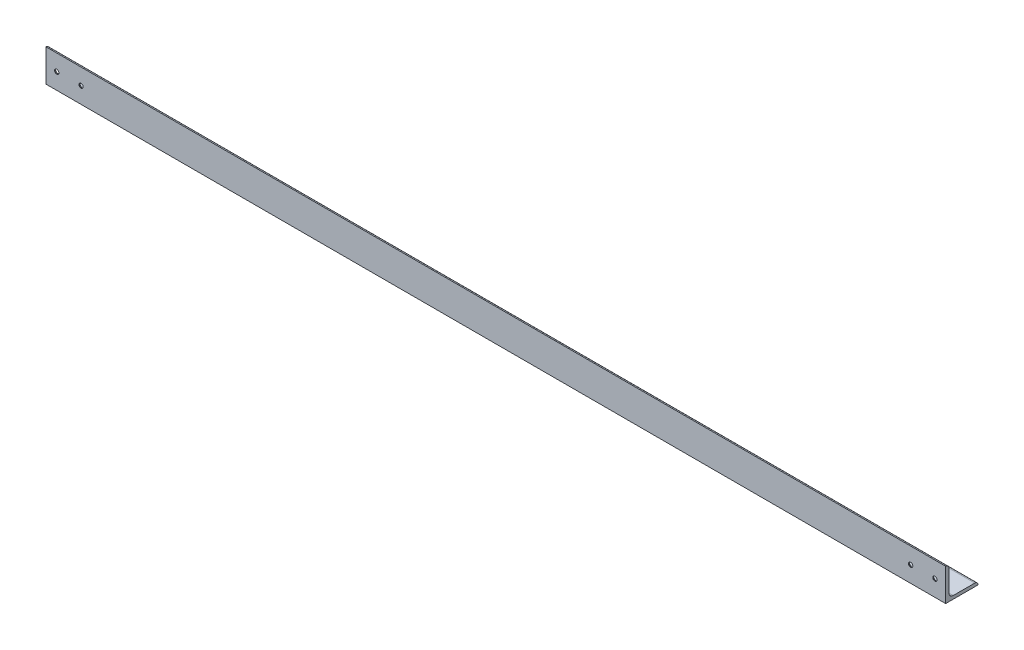
from build123d import *

# Parameters (mm, degrees)
L_ANGLE_EQUAL_60X60X6_6_DEPTH = 1670
SKETCH14_R                    = 4
CUT_EXTRUDE1_DEPTH            = 1673.1542991
CHAMFER1_SIZE                 = 5.5
SKETCH18_R                    = 4
CUT_EXTRUDE2_DEPTH            = 1673.1542991
LPATTERN1_COUNT               = 5
LPATTERN1_PITCH               = 400
LPATTERN1_COUNT_DIR2          = 5
LPATTERN1_PITCH_DIR2          = 400


with BuildPart() as part:
    # Sketch17 → L angle (equal) 60X60X6(6) (new body)
    with BuildSketch(Plane(origin=(0, 0, 0), x_dir=(0, 0, -1), z_dir=(1, 0, 0))):
        with BuildLine():
            Line((0, 60), (0, 0))
            Line((0, 0), (60, 0))
            ThreePointArc((60, 0), (58.242640687, 4.242640687), (54, 6))
            Line((54, 6), (14, 6))
            ThreePointArc((14, 6), (8.343145751, 8.343145751), (6, 14))
            Line((6, 14), (6, 54))
            ThreePointArc((6, 54), (4.242640687, 58.242640687), (0, 60))
        make_face()
    extrude(amount=L_ANGLE_EQUAL_60X60X6_6_DEPTH)

    # Sketch14 → Cut-Extrude1 (cut, through all)
    with BuildSketch(Plane.XY):
        with Locations((65, 30)):
            Circle(SKETCH14_R)
        with Locations((1605, 30)):
            Circle(SKETCH14_R)
        with Locations((1650, 30)):
            Circle(SKETCH14_R)
        with Locations((20, 30)):
            Circle(SKETCH14_R)
    extrude(amount=-CUT_EXTRUDE1_DEPTH, mode=Mode.SUBTRACT)

    # Chamfer1
    chamfer1_edges = [part.edges().sort_by_distance(p)[0] for p in [
        (16, 30, -6),
        (1646, 30, -6),
        (1601, 30, -6),
        (61, 30, -6),
    ]]
    chamfer(chamfer1_edges, length=CHAMFER1_SIZE)

    # Sketch18 → Cut-Extrude2 (cut, through all)
    with BuildSketch(Plane(origin=(0, 0, 0), x_dir=(-1, 0, 0), z_dir=(0, -1, 0))):
        with Locations(Location((-35, 30, 0), (0, 0, 90))):
            Circle(SKETCH18_R)
    cut_extrude2 = extrude(amount=-CUT_EXTRUDE2_DEPTH, mode=Mode.SUBTRACT)

    # LPattern1: Cut-Extrude2 5 × 5
    with Locations(*[(i * LPATTERN1_PITCH, -j * LPATTERN1_PITCH_DIR2, 0) for i in range(LPATTERN1_COUNT) for j in range(LPATTERN1_COUNT_DIR2) if (i, j) != (0, 0)]):
        add(cut_extrude2, mode=Mode.SUBTRACT)


solid = part.part
